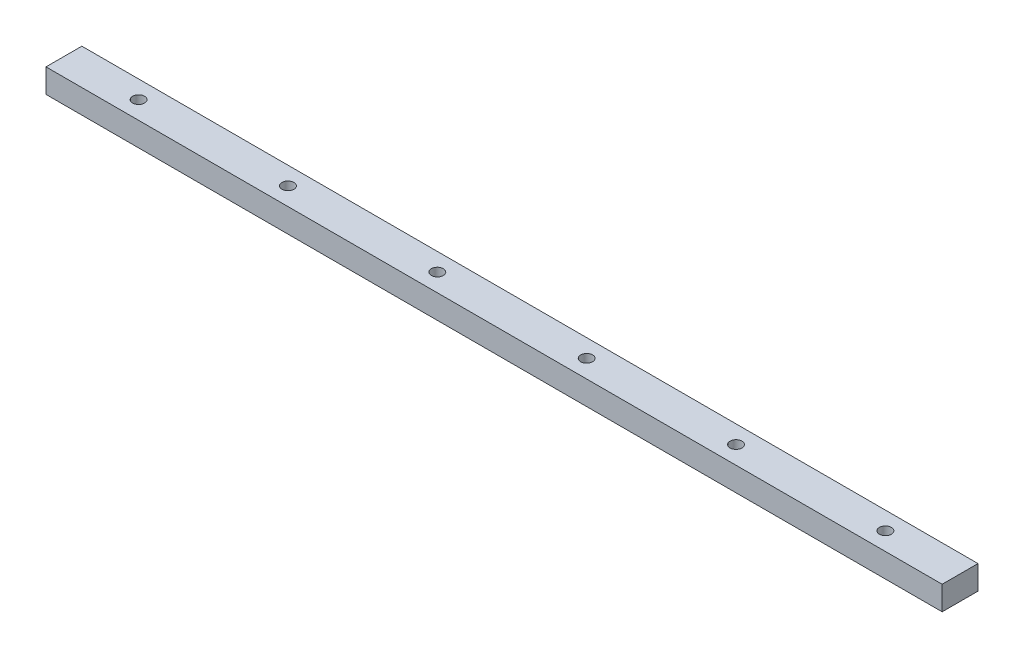
from build123d import *

# Parameters (mm, degrees)
SKETCH2_W           = 300
SKETCH2_H           = 12
SKETCH2_R           = 2
BOSS_EXTRUDE1_DEPTH = 4


with BuildPart() as part:
    # Sketch2 → Boss-Extrude1 (new, symmetric)
    with BuildSketch(Plane(origin=(0, 0, 0), x_dir=(1, 0, 0), z_dir=(0, 1, 0))):
        Rectangle(SKETCH2_W, SKETCH2_H)
        with Locations(Location((-125, 0, 0), (0, 0, 270))):
            Circle(SKETCH2_R, mode=Mode.SUBTRACT)
        with Locations(Location((-75, 0, 0), (0, 0, 270))):
            Circle(SKETCH2_R, mode=Mode.SUBTRACT)
        with Locations(Location((-25, 0, 0), (0, 0, 270))):
            Circle(SKETCH2_R, mode=Mode.SUBTRACT)
        with Locations(Location((25, 0, 0), (0, 0, 270))):
            Circle(SKETCH2_R, mode=Mode.SUBTRACT)
        with Locations(Location((75, 0, 0), (0, 0, 270))):
            Circle(SKETCH2_R, mode=Mode.SUBTRACT)
        with Locations(Location((125, 0, 0), (0, 0, 270))):
            Circle(SKETCH2_R, mode=Mode.SUBTRACT)
    extrude(amount=BOSS_EXTRUDE1_DEPTH, both=True)


solid = part.part
